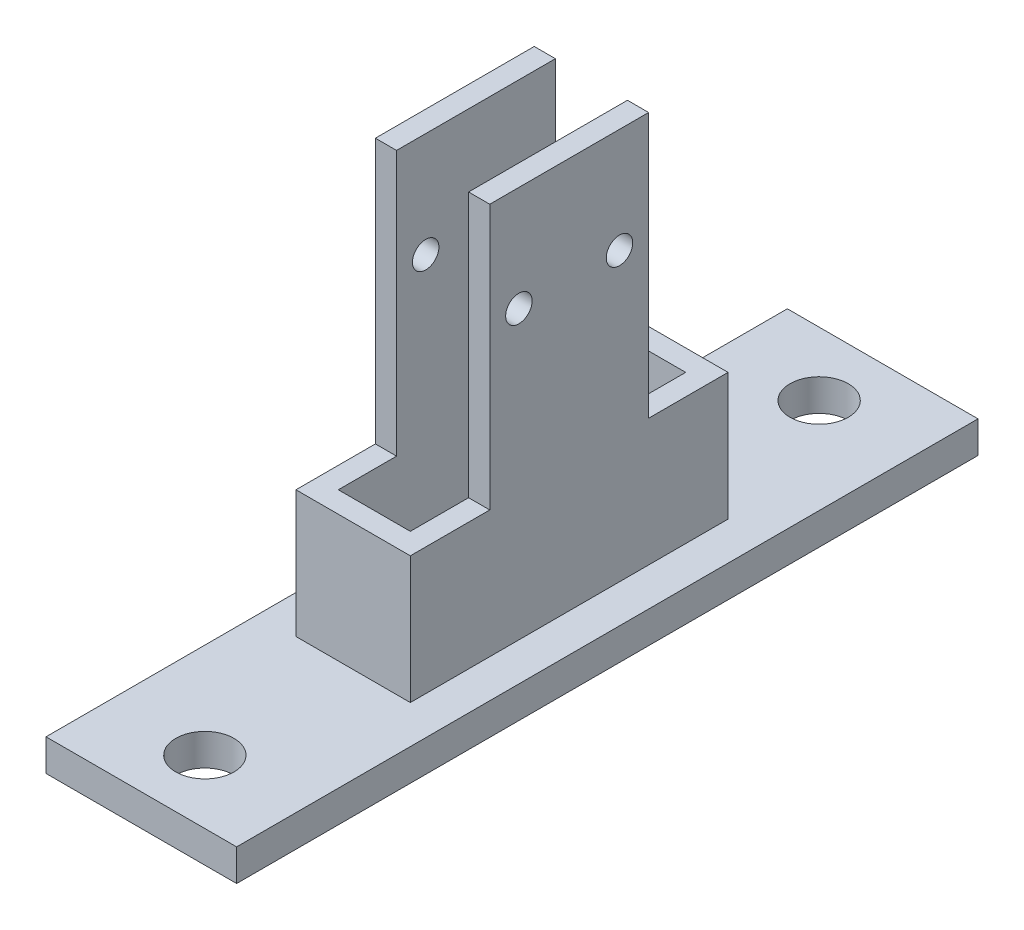
from build123d import *

# Parameters (mm, degrees)
SKETCH1_W            = 45
SKETCH1_H            = 30
BOSS_EXTRUDE1_DEPTH  = 3
SKETCH3_R            = 1.25
BOSS_EXTRUDE2_DEPTH  = 2
SKETCH4_W            = 10.8
SKETCH4_H            = 12
BOSS_EXTRUDE3_DEPTH  = 2
SKETCH10_W           = 18
SKETCH10_H           = 70
BOSS_EXTRUDE4_DEPTH  = 3
SKETCH11_W           = 13.5
SKETCH11_H           = 30
CUT_EXTRUDE1_DEPTH   = 3
M5_CLEARANCE_HOLE1_D = 5.5


with BuildPart() as part:
    # Sketch1 → Boss-Extrude1 (new body)
    with BuildSketch(Plane(origin=(0, 0, 0), x_dir=(1, 0, 0), z_dir=(0, 1, 0))):
        Rectangle(SKETCH1_W, SKETCH1_H)
    extrude(amount=BOSS_EXTRUDE1_DEPTH)

    # Sketch3 → Boss-Extrude2 (add)
    with BuildSketch(Plane(origin=(-3.4, 0, 0), x_dir=(0, 0, -1), z_dir=(1, 0, 0))):
        Polygon((7.5, 40), (-7.5, 40), (-7.5, 15), (-15, 15), (-15, 0), (15, 0), (15, 15), (7.5, 15), align=None)
        with Locations((-4.75, 30.1)):
            Circle(SKETCH3_R, mode=Mode.SUBTRACT)
        with Locations((4.75, 30.1)):
            Circle(SKETCH3_R, mode=Mode.SUBTRACT)
    extrude(amount=-BOSS_EXTRUDE2_DEPTH)

    # Mirror1: part across plane


with BuildPart() as part_1:
    add(part.part)
    add(part.part.mirror(Plane(origin=(0, 0, 0), x_dir=(0, 0, 1), z_dir=(1, 0, 0))))

    # Sketch4 → Boss-Extrude3 (add)
    with BuildSketch(Plane.XY.offset(15)):
        with Locations((0, 9)):
            Rectangle(SKETCH4_W, SKETCH4_H)
    boss_extrude3 = extrude(amount=-BOSS_EXTRUDE3_DEPTH)

    # Mirror2: Boss-Extrude3 across plane
    add(boss_extrude3.mirror(Plane.XY))

    # Sketch10 → Boss-Extrude4 (add)
    with BuildSketch(Plane(origin=(0, 3, 0), x_dir=(1, 0, 0), z_dir=(0, 1, 0))):
        Rectangle(SKETCH10_W, SKETCH10_H)
    extrude(amount=-BOSS_EXTRUDE4_DEPTH)

    # Sketch11 → Cut-Extrude1 (cut)
    with BuildSketch(Plane(origin=(0, 3, 0), x_dir=(1, 0, 0), z_dir=(0, 1, 0))):
        with Locations((-15.75, 0)):
            Rectangle(SKETCH11_W, SKETCH11_H)
    cut_extrude1 = extrude(amount=-CUT_EXTRUDE1_DEPTH, mode=Mode.SUBTRACT)

    # Mirror3: Cut-Extrude1 across plane
    add(cut_extrude1.mirror(Plane(origin=(0, 0, 0), x_dir=(0, 0, 1), z_dir=(1, 0, 0))), mode=Mode.SUBTRACT)

    # M5 Clearance Hole1 (through all)
    with Locations(Plane(origin=(0, 3, 0), x_dir=(1, 0, 0), z_dir=(0, 1, 0))):
        with Locations((0, -29), (0, 29)):
            Hole(M5_CLEARANCE_HOLE1_D / 2)


solid = part_1.part
